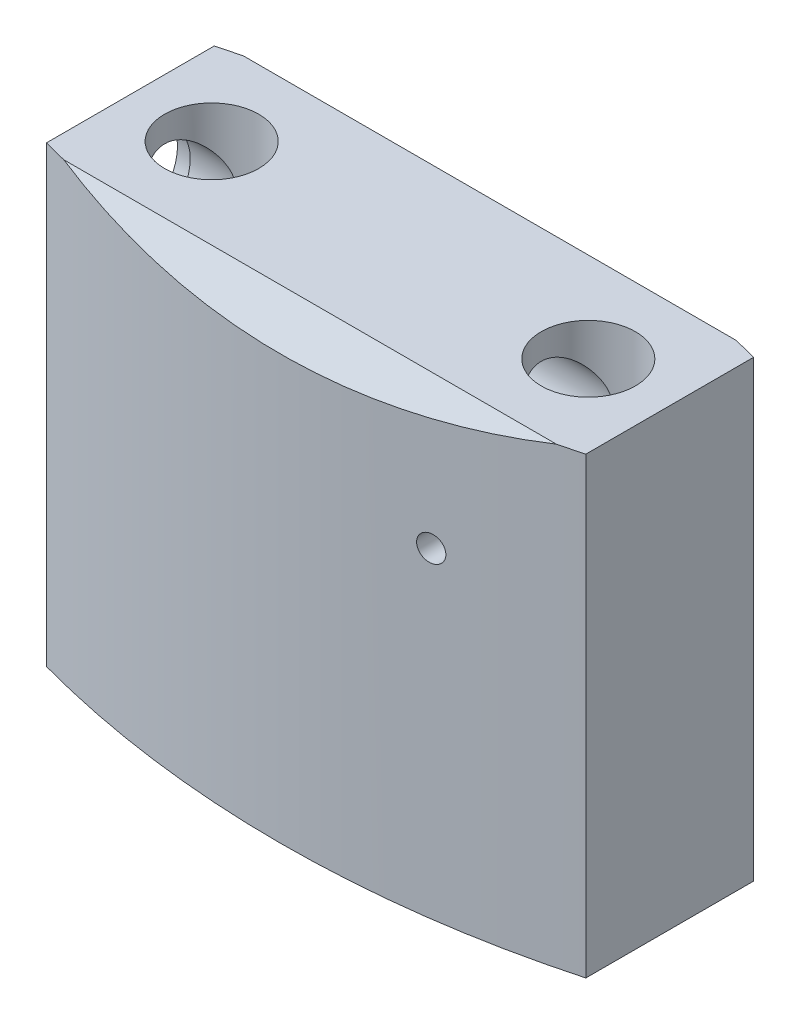
from build123d import *

# Parameters (mm, degrees)
EXTRUDE_1_DEPTH           = 53
CUT_EXTRUDE_1_DEPTH       = 84.510478384
CUT_EXTRUDE_1_DEPTH_BACK  = 84.510478384
CUT_EXTRUDE_2_DEPTH       = 64.223808806
CUT_EXTRUDE_2_DEPTH_BACK  = 14
SKETCH_4_R                = 5.5
SKETCH_4_3_R              = 5.5
CUT_EXTRUDE_3_DEPTH       = 45
CUT_EXTRUDE_START         = 45
SKETCH_4_4_R              = 1
CUT_EXTRUDE_4_DEPTH       = 109.223808806
SKETCH_5_R                = 5.5
CUT_EXTRUDE_5_DEPTH       = 2
CUT_EXTRUDE_6_REACH       = 85.51
CUT_EXTRUDE_6_END_RADIUS  = 5.5
SKETCH_5_3_R              = 5
SKETCH_7_R                = 9
SKETCH_7_R_2              = 7
CUT_EXTRUDE_7_DEPTH       = 1
SKETCH_9_R                = 7
CUT_EXTRUDE_9_DEPTH       = 2
SKETCH_10_R               = 6
CUT_EXTRUDE_10_DEPTH      = 42
CUT_EXTRUDE_11_DEPTH      = 64.22380889
CUT_EXTRUDE_11_DEPTH_BACK = 64.22380889
SKETCH_11_R               = 1.5
SKETCH_12_R               = 1.6
CUT_EXTRUDE_16_DEPTH      = 1.5
CUT_EXTRUDE_17_REACH      = 84.385
SKETCH_17_R               = 1.5


with BuildPart() as part:
    # 草图2 → 凸台-拉伸1 (new body)
    with BuildSketch(Plane(origin=(0, 0, 0), x_dir=(1, 0, 0), z_dir=(0, 1, 0))):
        with BuildLine():
            ThreePointArc((31.5, 9.791839091), (0, 14), (-31.5, 9.791839091))
            Line((-31.5, 9.791839091), (-31.5, -9.791839091))
            ThreePointArc((-31.5, -9.791839091), (0, -14), (31.5, -9.791839091))
            Line((31.5, -9.791839091), (31.5, 9.791839091))
        make_face()
    extrude(amount=EXTRUDE_1_DEPTH)

    # 草图3 → 切除-拉伸1 (cut, two sides: drawn at the far end of the back side and taken through both)
    with BuildSketch(Plane(origin=(31.5, 0, 0), x_dir=(0, 0, -1), z_dir=(1, 0, 0)).offset(-CUT_EXTRUDE_1_DEPTH_BACK)):
        Polygon((-14, 53), (-10.5, 53), (-14, 49.5), align=None)
        Polygon((14, 53), (14, 49.5), (10.5, 53), align=None)
    extrude(amount=CUT_EXTRUDE_1_DEPTH + CUT_EXTRUDE_1_DEPTH_BACK, mode=Mode.SUBTRACT)

    # 草图4 → 切除-拉伸2 (cut, two sides: drawn at the far end of the back side and taken through both)
    with BuildSketch(Plane(origin=(0, 53, 0), x_dir=(1, 0, 0), z_dir=(0, 1, 0)).offset(-CUT_EXTRUDE_2_DEPTH_BACK)):
        with Locations((-22, 0)):
            Circle(SKETCH_4_R)
    extrude(amount=CUT_EXTRUDE_2_DEPTH + CUT_EXTRUDE_2_DEPTH_BACK, mode=Mode.SUBTRACT)

    # 草图4<3> → 切除-拉伸3 (cut)
    with BuildSketch(Plane(origin=(0, 53, 0), x_dir=(1, 0, 0), z_dir=(0, 1, 0))):
        with Locations((22, 0)):
            Circle(SKETCH_4_3_R)
    extrude(amount=-CUT_EXTRUDE_3_DEPTH, mode=Mode.SUBTRACT)

    # 草图4<4> → 切除-拉伸4 (cut, through all)
    with BuildSketch(Plane(origin=(0, 53, 0), x_dir=(1, 0, 0), z_dir=(0, 1, 0)).offset(CUT_EXTRUDE_START)):
        with Locations((22, 0)):
            Circle(SKETCH_4_4_R)
    extrude(amount=-CUT_EXTRUDE_4_DEPTH, mode=Mode.SUBTRACT)

    # 草图5 → 切除-拉伸5 (cut)
    with BuildSketch(Plane.ZY.offset(31.5)):
        with Locations((0, 45)):
            Circle(SKETCH_5_R)
    extrude(amount=-CUT_EXTRUDE_5_DEPTH, mode=Mode.SUBTRACT)

    # 切除-拉伸6: up to this cylinder (the profile starts outside it)
    cut_extrude_6_end = Plane(origin=(22, 45, 0), z_dir=(0, 1, 0)) * Cylinder(CUT_EXTRUDE_6_END_RADIUS, 183.02, mode=Mode.PRIVATE)
    # 草图5<3> → 切除-拉伸6 (cut, up to the surface)
    with BuildSketch(Plane.ZY.offset(31.5), mode=Mode.PRIVATE) as cut_extrude_6_sk1:
        with Locations((0, 45)):
            Circle(SKETCH_5_3_R)
    cut_extrude_6_tool1 = extrude(cut_extrude_6_sk1.sketch, amount=-CUT_EXTRUDE_6_REACH, mode=Mode.PRIVATE) - cut_extrude_6_end
    add(cut_extrude_6_tool1.solids().sort_by_distance((-31.5, 45, 0))[0], mode=Mode.SUBTRACT)

    # 草图7 → 切除-拉伸7 (cut)
    with BuildSketch(Plane.XZ):
        Circle(SKETCH_7_R)
        Circle(SKETCH_7_R_2, mode=Mode.SUBTRACT)
    extrude(amount=-CUT_EXTRUDE_7_DEPTH, mode=Mode.SUBTRACT)

    # 草图9 → 切除-拉伸9 (cut)
    with BuildSketch(Plane.XZ):
        Circle(SKETCH_9_R)
    extrude(amount=-CUT_EXTRUDE_9_DEPTH, mode=Mode.SUBTRACT)

    # 草图10 → 切除-拉伸10 (cut)
    with BuildSketch(Plane.XZ.offset(-2)):
        Circle(SKETCH_10_R)
    extrude(amount=-CUT_EXTRUDE_10_DEPTH, mode=Mode.SUBTRACT)

    # 草图11 → 切除-拉伸11 (cut, two sides: drawn at the far end of the back side and taken through both)
    with BuildSketch(Plane.XY.offset(-CUT_EXTRUDE_11_DEPTH_BACK)):
        with Locations((16.5, 37.5)):
            Circle(SKETCH_11_R)
    extrude(amount=CUT_EXTRUDE_11_DEPTH + CUT_EXTRUDE_11_DEPTH_BACK, mode=Mode.SUBTRACT)

    # 草图12 → 切除-拉伸16 (cut)
    with BuildSketch(Plane.ZY.offset(31.5)):
        with Locations((0, 28.6)):
            Circle(SKETCH_12_R)
        with Locations((0, 24.6)):
            Circle(SKETCH_12_R)
        with Locations((0, 20.6)):
            Circle(SKETCH_12_R)
        with Locations((0, 16.6)):
            Circle(SKETCH_12_R)
        with Locations((0, 12.6)):
            Circle(SKETCH_12_R)
        with Locations((0, 8.6)):
            Circle(SKETCH_12_R)
        with Locations((0, 4.6)):
            Circle(SKETCH_12_R)
    extrude(amount=-CUT_EXTRUDE_16_DEPTH, mode=Mode.SUBTRACT)

    # 草图17 → 切除-拉伸17 (cut, up to next)
    with BuildSketch(Plane.ZY.offset(30), mode=Mode.PRIVATE) as cut_extrude_17_sk1:
        with Locations((0, 28.6)):
            Circle(SKETCH_17_R)
    cut_extrude_17_tool1 = extrude(cut_extrude_17_sk1.sketch, amount=-CUT_EXTRUDE_17_REACH, mode=Mode.PRIVATE) & part.part
    # 草图17 → 切除-拉伸17 (cut, up to next)
    with BuildSketch(Plane.ZY.offset(30), mode=Mode.PRIVATE) as cut_extrude_17_sk2:
        with Locations((0, 24.6)):
            Circle(SKETCH_17_R)
    cut_extrude_17_tool2 = extrude(cut_extrude_17_sk2.sketch, amount=-CUT_EXTRUDE_17_REACH, mode=Mode.PRIVATE) & part.part
    # 草图17 → 切除-拉伸17 (cut, up to next)
    with BuildSketch(Plane.ZY.offset(30), mode=Mode.PRIVATE) as cut_extrude_17_sk3:
        with Locations((0, 20.6)):
            Circle(SKETCH_17_R)
    cut_extrude_17_tool3 = extrude(cut_extrude_17_sk3.sketch, amount=-CUT_EXTRUDE_17_REACH, mode=Mode.PRIVATE) & part.part
    # 草图17 → 切除-拉伸17 (cut, up to next)
    with BuildSketch(Plane.ZY.offset(30), mode=Mode.PRIVATE) as cut_extrude_17_sk4:
        with Locations((0, 16.6)):
            Circle(SKETCH_17_R)
    cut_extrude_17_tool4 = extrude(cut_extrude_17_sk4.sketch, amount=-CUT_EXTRUDE_17_REACH, mode=Mode.PRIVATE) & part.part
    # 草图17 → 切除-拉伸17 (cut, up to next)
    with BuildSketch(Plane.ZY.offset(30), mode=Mode.PRIVATE) as cut_extrude_17_sk5:
        with Locations((0, 12.6)):
            Circle(SKETCH_17_R)
    cut_extrude_17_tool5 = extrude(cut_extrude_17_sk5.sketch, amount=-CUT_EXTRUDE_17_REACH, mode=Mode.PRIVATE) & part.part
    # 草图17 → 切除-拉伸17 (cut, up to next)
    with BuildSketch(Plane.ZY.offset(30), mode=Mode.PRIVATE) as cut_extrude_17_sk6:
        with Locations((0, 8.6)):
            Circle(SKETCH_17_R)
    cut_extrude_17_tool6 = extrude(cut_extrude_17_sk6.sketch, amount=-CUT_EXTRUDE_17_REACH, mode=Mode.PRIVATE) & part.part
    # 草图17 → 切除-拉伸17 (cut, up to next)
    with BuildSketch(Plane.ZY.offset(30), mode=Mode.PRIVATE) as cut_extrude_17_sk7:
        with Locations((0, 4.6)):
            Circle(SKETCH_17_R)
    cut_extrude_17_tool7 = extrude(cut_extrude_17_sk7.sketch, amount=-CUT_EXTRUDE_17_REACH, mode=Mode.PRIVATE) & part.part
    add(cut_extrude_17_tool1.solids().sort_by_distance((-30, 28.6, 0))[0], mode=Mode.SUBTRACT)
    add(cut_extrude_17_tool2.solids().sort_by_distance((-30, 24.6, 0))[0], mode=Mode.SUBTRACT)
    add(cut_extrude_17_tool3.solids().sort_by_distance((-30, 20.6, 0))[0], mode=Mode.SUBTRACT)
    add(cut_extrude_17_tool4.solids().sort_by_distance((-30, 16.6, 0))[0], mode=Mode.SUBTRACT)
    add(cut_extrude_17_tool5.solids().sort_by_distance((-30, 12.6, 0))[0], mode=Mode.SUBTRACT)
    add(cut_extrude_17_tool6.solids().sort_by_distance((-30, 8.6, 0))[0], mode=Mode.SUBTRACT)
    add(cut_extrude_17_tool7.solids().sort_by_distance((-30, 4.6, 0))[0], mode=Mode.SUBTRACT)


solid = part.part
